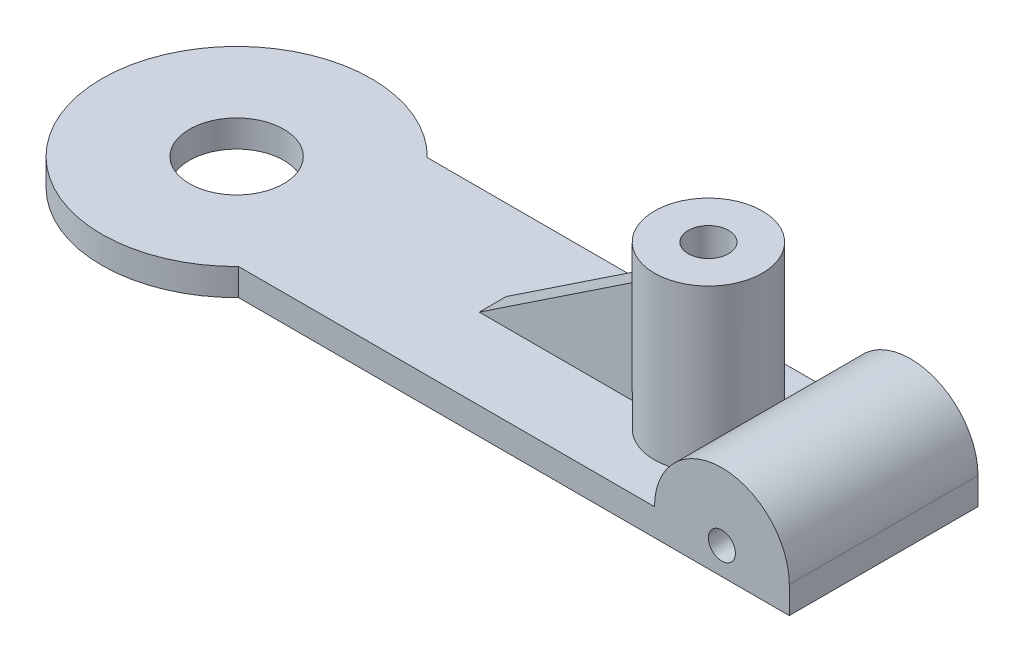
from build123d import *

# Parameters (mm, degrees)
SKETCH2_R           = 17.5
BOSS_EXTRUDE1_DEPTH = 10
SKETCH3_R           = 20
SKETCH3_R_2         = 7.5
BOSS_EXTRUDE2_DEPTH = 60
BOSS_EXTRUDE7_DEPTH = 5
BOSS_EXTRUDE8_DEPTH = 35
SKETCH5_R           = 5
CUT_EXTRUDE1_DEPTH  = 70


with BuildPart() as part:
    # Sketch2 → Boss-Extrude1 (new body)
    with BuildSketch(Plane(origin=(0, 0, 0), x_dir=(1, 0, 0), z_dir=(0, 1, 0))):
        with BuildLine():
            Line((0, -35), (-204.292857857, -35))
            ThreePointArc((-204.292857857, -35), (-290, 0), (-204.292857857, 35))
            Line((-204.292857857, 35), (0, 35))
            Line((0, 35), (0, -35))
        make_face()
        with Locations((-240, 0)):
            Circle(SKETCH2_R, mode=Mode.SUBTRACT)
    extrude(amount=BOSS_EXTRUDE1_DEPTH)

    # Sketch3 → Boss-Extrude2 (add)
    with BuildSketch(Plane(origin=(0, 10, 0), x_dir=(1, 0, 0), z_dir=(0, 1, 0))):
        with Locations((-65, 0)):
            Circle(SKETCH3_R)
        with Locations((-65, 0)):
            Circle(SKETCH3_R_2, mode=Mode.SUBTRACT)
    extrude(amount=BOSS_EXTRUDE2_DEPTH)

    # Sketch4 → Boss-Extrude7 (add, symmetric)
    with BuildSketch(Plane.XY):
        Polygon((-81.055755384, 10), (-81.055755384, 52.629496411), (-145, 10), align=None)
    extrude(amount=BOSS_EXTRUDE7_DEPTH, both=True)

    # Sketch4<6> → Boss-Extrude8 (add, symmetric)
    with BuildSketch(Plane.XY):
        with BuildLine():
            ThreePointArc((0, 10), (-25, 35), (-50, 10))
            Line((-50, 10), (0, 10))
        make_face()
    extrude(amount=BOSS_EXTRUDE8_DEPTH, both=True)

    # Sketch5 → Cut-Extrude1 (cut)
    with BuildSketch(Plane.XY.offset(35)):
        with Locations((-25, 10)):
            Circle(SKETCH5_R)
    extrude(amount=-CUT_EXTRUDE1_DEPTH, mode=Mode.SUBTRACT)


solid = part.part
